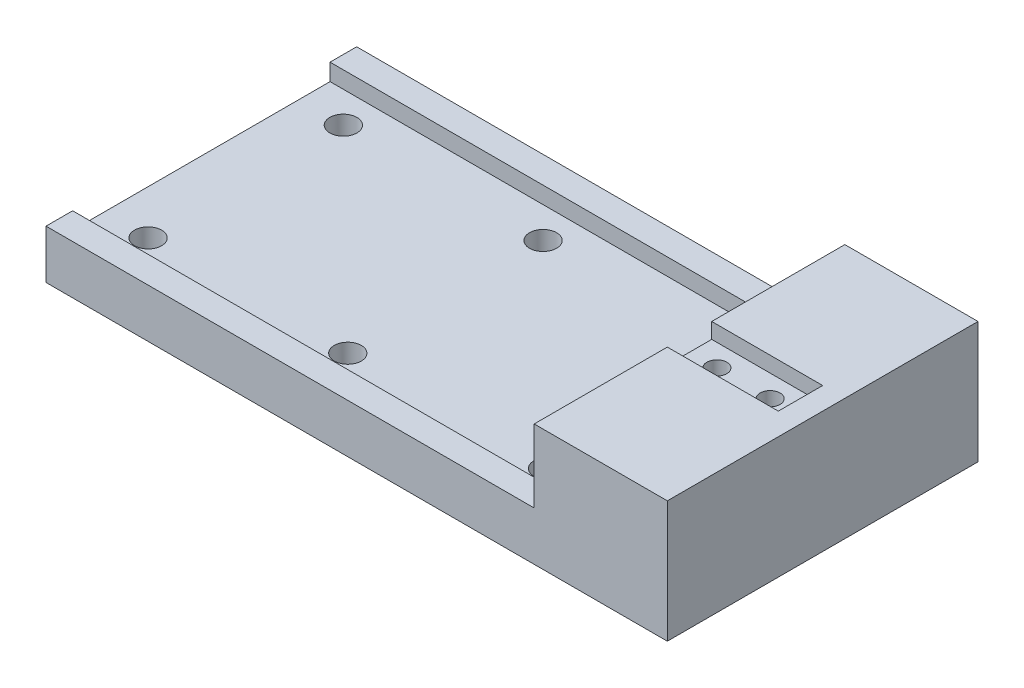
from build123d import *

# Parameters (mm, degrees)
ESQUISSE1_W             = 140
ESQUISSE1_H             = 11
BOSS_EXTRU_1_DEPTH      = 70
ENL_V_MAT_EXTRU_1_DEPTH = 110
ESQUISSE6_W             = 30
ESQUISSE6_H             = 70
BOSS_EXTRU_3_DEPTH      = 16.4
ESQUISSE9_W             = 10
ESQUISSE9_H             = 3.5
ENL_V_MAT_EXTRU_3_DEPTH = 25
ESQUISSE10_R            = 2.25
ENL_V_MAT_EXTRU_4_DEPTH = 10.8
ESQUISSE12_W            = 110
ESQUISSE12_H            = 29
ESQUISSE12_R            = 3.05
ESQUISSE12_H_2          = 9.4
ENL_V_MAT_EXTRU_6_DEPTH = 3.8
ESQUISSE12_3_R          = 3.05
ENL_V_MAT_EXTRU_7_DEPTH = 12
BOSS_EXTRU_4_REACH      = 103.035
ESQUISSE13_W            = 110
ESQUISSE13_H            = 17.195348208


with BuildPart() as part:
    # Esquisse1 → Boss.-Extru.1 (new body)
    with BuildSketch(Plane.XY):
        Rectangle(ESQUISSE1_W, ESQUISSE1_H)
    extrude(amount=BOSS_EXTRU_1_DEPTH)

    # Esquisse2 → Enlèv. mat.-Extru.1 (cut)
    with BuildSketch(Plane.ZY.offset(70)):
        with BuildLine():
            Line((25.6, 5.5), (44.4, 5.5))
            ThreePointArc((44.4, 5.5), (35, -3.9), (25.6, 5.5))
        make_face()
    extrude(amount=-ENL_V_MAT_EXTRU_1_DEPTH, mode=Mode.SUBTRACT)

    # Esquisse6 → Boss.-Extru.3 (add)
    with BuildSketch(Plane(origin=(0, 5.5, 0), x_dir=(1, 0, 0), z_dir=(0, 1, 0))):
        with Locations((55, -35)):
            Rectangle(ESQUISSE6_W, ESQUISSE6_H)
    extrude(amount=BOSS_EXTRU_3_DEPTH)

    # Esquisse9 → Enlèv. mat.-Extru.3 (cut)
    with BuildSketch(Plane.ZY.offset(-40)):
        with Locations((35, 9.25)):
            Rectangle(ESQUISSE9_W, ESQUISSE9_H)
        with Locations((35, 20.15)):
            Rectangle(ESQUISSE9_W, ESQUISSE9_H)
    extrude(amount=-ENL_V_MAT_EXTRU_3_DEPTH, mode=Mode.SUBTRACT)

    # Esquisse10 → Enlèv. mat.-Extru.4 (cut)
    with BuildSketch(Plane(origin=(0, 18.4, 0), x_dir=(1, 0, 0), z_dir=(0, 1, 0))):
        with Locations(Location((58.15, -35, 0), (0, 0, 270))):
            Circle(ESQUISSE10_R)
        with Locations(Location((46.15, -35, 0), (0, 0, 270))):
            Circle(ESQUISSE10_R)
    extrude(amount=-ENL_V_MAT_EXTRU_4_DEPTH, mode=Mode.SUBTRACT)

    # Esquisse12 → Enlèv. mat.-Extru.6 (cut)
    # profile 1 of 3: a face of its own
    with BuildSketch(Plane(origin=(0, 5.5, 0), x_dir=(1, 0, 0), z_dir=(0, 1, 0))):
        with Locations((-15, -20.5)):
            Rectangle(ESQUISSE12_W, ESQUISSE12_H)
        with Locations(Location((30, -13, 0), (0, 0, 270))):
            Circle(ESQUISSE12_R, mode=Mode.SUBTRACT)
        with Locations(Location((-15, -13, 0), (0, 0, 270))):
            Circle(ESQUISSE12_R, mode=Mode.SUBTRACT)
        with Locations(Location((-60, -13, 0), (0, 0, 270))):
            Circle(ESQUISSE12_R, mode=Mode.SUBTRACT)
    # profile 2 of 3: a face of its own
    with BuildSketch(Plane(origin=(0, 5.5, 0), x_dir=(1, 0, 0), z_dir=(0, 1, 0))):
        with Locations((-15, -49.5)):
            Rectangle(ESQUISSE12_W, ESQUISSE12_H)
        with Locations(Location((-15, -57, 0), (0, 0, 270))):
            Circle(ESQUISSE12_R, mode=Mode.SUBTRACT)
        with Locations(Location((-60, -57, 0), (0, 0, 270))):
            Circle(ESQUISSE12_R, mode=Mode.SUBTRACT)
        with Locations(Location((30, -57, 0), (0, 0, 270))):
            Circle(ESQUISSE12_R, mode=Mode.SUBTRACT)
    # profile 3 of 3: a face of its own
    with BuildSketch(Plane(origin=(0, 5.5, 0), x_dir=(1, 0, 0), z_dir=(0, 1, 0))):
        with Locations((-15, -39.7)):
            Rectangle(ESQUISSE12_W, ESQUISSE12_H_2)
    extrude(amount=-ENL_V_MAT_EXTRU_6_DEPTH, mode=Mode.SUBTRACT)

    # Esquisse12<3> → Enlèv. mat.-Extru.7 (cut)
    with BuildSketch(Plane(origin=(0, 5.5, 0), x_dir=(1, 0, 0), z_dir=(0, 1, 0))):
        with Locations(Location((-60, -13, 0), (0, 0, 270))):
            Circle(ESQUISSE12_3_R)
        with Locations(Location((-15, -13, 0), (0, 0, 270))):
            Circle(ESQUISSE12_3_R)
        with Locations(Location((30, -13, 0), (0, 0, 270))):
            Circle(ESQUISSE12_3_R)
        with Locations(Location((30, -57, 0), (0, 0, 270))):
            Circle(ESQUISSE12_3_R)
        with Locations(Location((-60, -57, 0), (0, 0, 270))):
            Circle(ESQUISSE12_3_R)
        with Locations(Location((-15, -57, 0), (0, 0, 270))):
            Circle(ESQUISSE12_3_R)
    extrude(amount=-ENL_V_MAT_EXTRU_7_DEPTH, mode=Mode.SUBTRACT)

    # Esquisse13 → Boss.-Extru.4 (add, up to next)
    with BuildSketch(Plane(origin=(0, 1.7, 0), x_dir=(1, 0, 0), z_dir=(0, 1, 0)), mode=Mode.PRIVATE) as boss_extru_4_sk1:
        with Locations((-15, -35)):
            Rectangle(ESQUISSE13_W, ESQUISSE13_H)
    boss_extru_4_tool1 = extrude(boss_extru_4_sk1.sketch, amount=-BOSS_EXTRU_4_REACH, mode=Mode.PRIVATE) - part.part
    add(boss_extru_4_tool1.solids().sort_by_distance((-15, 1.7, 35))[0])


solid = part.part
